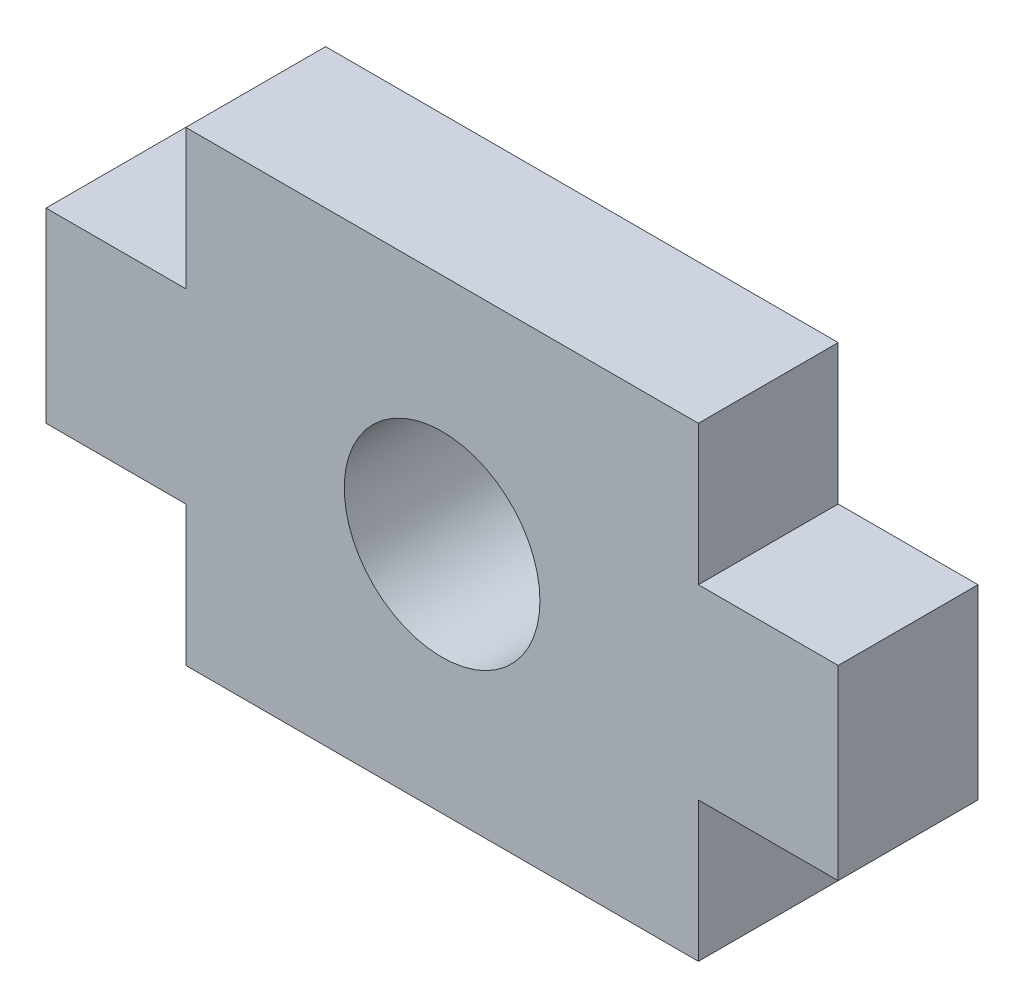
from build123d import *

# Parameters (mm, degrees)
SKETCH1_W               = 11
SKETCH1_H               = 10
BOSS_EXTRUDE1_DEPTH     = 1.5
SKETCH3_W               = 3
SKETCH3_H               = 4
BOSS_EXTRUDE2_DEPTH     = 1.5
CUT_EXTRUDE1_DEPTH      = 10.974968672
CUT_EXTRUDE1_DEPTH_BACK = 10.974968672
SKETCH4_R               = 2.1


with BuildPart() as part:
    # Sketch1 → Boss-Extrude1 (new, symmetric)
    with BuildSketch(Plane.XY):
        Rectangle(SKETCH1_W, SKETCH1_H)
    extrude(amount=BOSS_EXTRUDE1_DEPTH, both=True)

    # Sketch3 → Boss-Extrude2 (add, symmetric)
    with BuildSketch(Plane.XY):
        with Locations((-7, 0)):
            Rectangle(SKETCH3_W, SKETCH3_H)
        with Locations((7, 0)):
            Rectangle(SKETCH3_W, SKETCH3_H)
    extrude(amount=BOSS_EXTRUDE2_DEPTH, both=True)

    # Sketch4 → Cut-Extrude1 (cut, two sides: drawn at the far end of the back side and taken through both)
    with BuildSketch(Plane.XY.offset(-CUT_EXTRUDE1_DEPTH_BACK)):
        Circle(SKETCH4_R)
    extrude(amount=CUT_EXTRUDE1_DEPTH + CUT_EXTRUDE1_DEPTH_BACK, mode=Mode.SUBTRACT)


solid = part.part
